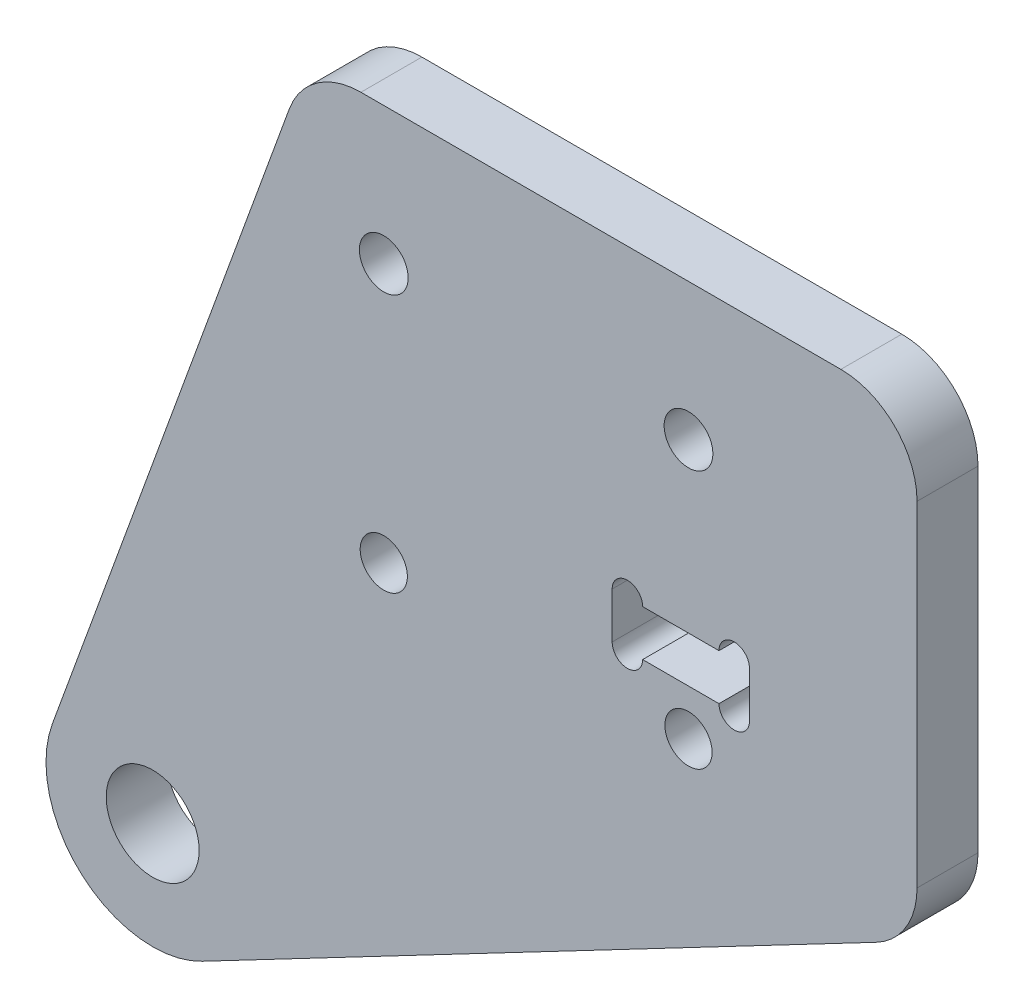
from build123d import *

# Parameters (mm, degrees)
SKETCH_1_R          = 1.6
EXTRUDE_1_DEPTH     = 4
FILLET_1_R          = 7
SKETCH_2_R          = 3.05
CUT_EXTRUDE_1_DEPTH = 5.5
FILLET_2_R          = 5
SKETCH_4_R          = 1.55
CUT_EXTRUDE_3_DEPTH = 5


with BuildPart() as part:
    # 草图1 → 凸台-拉伸1 (new body)
    with BuildSketch(Plane.XY):
        Polygon((0, 0), (40, 0), (40, -30), (-22.930124759, -63), align=None)
        with Locations((5, -9)):
            Circle(SKETCH_1_R, mode=Mode.SUBTRACT)
        with Locations((25, -9)):
            Circle(SKETCH_1_R, mode=Mode.SUBTRACT)
    extrude(amount=EXTRUDE_1_DEPTH)

    # 圆角1
    fillet_1_edges = [part.edges().sort_by_distance(p)[0] for p in [
        (-22.930124759, -63, 2),
    ]]
    fillet(fillet_1_edges, radius=FILLET_1_R)

    # 草图2 → 切除-拉伸1 (cut)
    with BuildSketch(Plane.XY.offset(4)):
        with Locations((-10.168271669, -48.403727607)):
            Circle(SKETCH_2_R)
    extrude(amount=-CUT_EXTRUDE_1_DEPTH, mode=Mode.SUBTRACT)

    # 圆角2
    fillet_2_edges = [part.edges().sort_by_distance(p)[0] for p in [
        (0, 0, 2),
        (40, 0, 2),
        (40, -30, 2),
    ]]
    fillet(fillet_2_edges, radius=FILLET_2_R)

    # 草图4 → 切除-拉伸3 (cut)
    with BuildSketch(Plane(origin=(0, 0, 0), x_dir=(-1, 0, 0), z_dir=(0, 0, -1))):
        with Locations((-25, -26)):
            Circle(SKETCH_4_R)
        with Locations((-5, -26)):
            Circle(SKETCH_4_R)
        with BuildLine():
            Line((-21.99, -23), (-27, -23))
            ThreePointArc((-27, -23), (-28, -24), (-29, -23))
            Line((-29, -23), (-29, -19.99))
            ThreePointArc((-29, -19.99), (-28, -18.99), (-27, -19.99))
            Line((-27, -19.99), (-21.99, -19.99))
            ThreePointArc((-21.99, -19.99), (-20.99, -18.99), (-19.99, -19.99))
            Line((-19.99, -19.99), (-19.99, -23))
            ThreePointArc((-19.99, -23), (-20.99, -24), (-21.99, -23))
        make_face()
    extrude(amount=-CUT_EXTRUDE_3_DEPTH, mode=Mode.SUBTRACT)


solid = part.part
